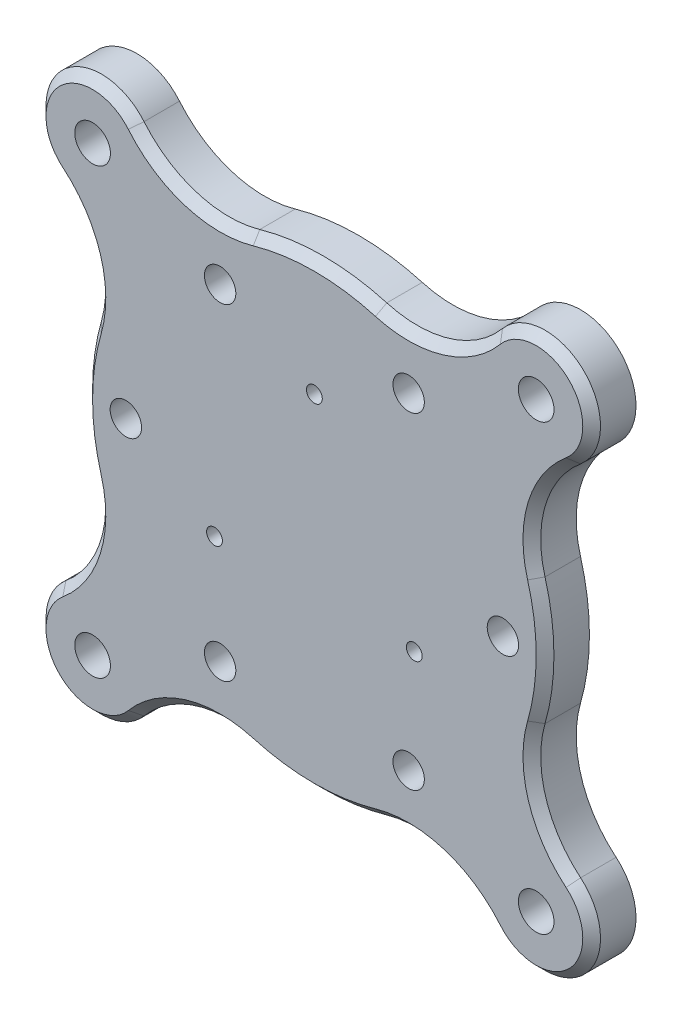
from build123d import *

# Parameters (mm, degrees)
SKETCH1_R                                      = 53.975
BOSS_EXTRUDE1_DEPTH                            = 6.35
CSK_FOR_8_FLAT_HEAD_MACHINE_SCREW1_D           = 4.4958
CSK_FOR_8_FLAT_HEAD_MACHINE_SCREW1_CSINK_D     = 9.7575878
CSK_FOR_8_FLAT_HEAD_MACHINE_SCREW1_CSINK_ANGLE = 82
CIRPATTERN1_COUNT                              = 6
F_10_CLEARANCE_HOLE1_D                         = 5.1054
CIRPATTERN2_COUNT                              = 4
F_4_40_TAPPED_HOLE1_D                          = 2.2606
CIRPATTERN3_COUNT                              = 3
CUT_EXTRUDE2_DEPTH                             = 77.59584682
CIRPATTERN4_COUNT                              = 4
CHAMFER1_SIZE                                  = 1.27


with BuildPart() as part:
    # Sketch1 → Boss-Extrude1 (new body)
    with BuildSketch(Plane.XY):
        Circle(SKETCH1_R)
    extrude(amount=BOSS_EXTRUDE1_DEPTH)

    # CSK for #8 Flat Head Machine Screw1 (through all)
    with Locations(Plane(origin=(0, 0, 0), x_dir=(-1, 0, 0), z_dir=(0, 0, -1))):
        with Locations((-13.49375, 23.371860585)):
            csk_for_8_flat_head_machine_screw1 = CounterSinkHole(CSK_FOR_8_FLAT_HEAD_MACHINE_SCREW1_D / 2, CSK_FOR_8_FLAT_HEAD_MACHINE_SCREW1_CSINK_D / 2, counter_sink_angle=CSK_FOR_8_FLAT_HEAD_MACHINE_SCREW1_CSINK_ANGLE)

    # CirPattern1: CSK for #8 Flat Head Machine Screw1 ×6 about axis
    cirpattern1_axis = Axis((0, 0, 0), (0, 0, 1))
    for i in range(1, CIRPATTERN1_COUNT):
        add(csk_for_8_flat_head_machine_screw1.rotate(cirpattern1_axis, i * 360 / CIRPATTERN1_COUNT), mode=Mode.SUBTRACT)

    # #10 Clearance Hole1 (through all)
    with Locations(Plane.XY.offset(6.35)):
        with Locations((31.75, 31.75)):
            f_10_clearance_hole1 = Hole(F_10_CLEARANCE_HOLE1_D / 2)

    # CirPattern2: #10 Clearance Hole1 ×4 about axis
    cirpattern2_axis = Axis((0, 0, 0), (0, 0, 1))
    for i in range(1, CIRPATTERN2_COUNT):
        add(f_10_clearance_hole1.rotate(cirpattern2_axis, i * 360 / CIRPATTERN2_COUNT), mode=Mode.SUBTRACT)

    # #4-40 Tapped Hole1 (through all)
    with Locations(Plane.XY.offset(6.35)):
        with Locations((0, 16.51)):
            f_4_40_tapped_hole1 = Hole(F_4_40_TAPPED_HOLE1_D / 2)

    # CirPattern3: #4-40 Tapped Hole1 ×3 about axis
    cirpattern3_axis = Axis((0, 0, 0), (0, 0, 1))
    for i in range(1, CIRPATTERN3_COUNT):
        add(f_4_40_tapped_hole1.rotate(cirpattern3_axis, i * 360 / CIRPATTERN3_COUNT), mode=Mode.SUBTRACT)

    # Sketch9 → Cut-Extrude2 (cut, through all)
    with BuildSketch(Plane(origin=(0, 0, 0), x_dir=(-1, 0, 0), z_dir=(0, 0, -1))):
        with BuildLine():
            Line((-37.362660076, 37.362660076), (-38.166088515, 38.166088515))
            ThreePointArc((-38.166088515, 38.166088515), (0, 53.975), (38.166088515, 38.166088515))
            Line((38.166088515, 38.166088515), (37.362660076, 37.362660076))
            ThreePointArc((37.362660076, 37.362660076), (31.392484898, 39.679444445), (25.65502333, 36.834797503))
            ThreePointArc((25.65502333, 36.834797503), (18.130045784, 31.830282128), (9.09329402, 31.74322611))
            ThreePointArc((9.09329402, 31.74322611), (0, 33.02), (-9.09329402, 31.74322611))
            ThreePointArc((-9.09329402, 31.74322611), (-18.130045784, 31.830282128), (-25.65502333, 36.834797503))
            ThreePointArc((-25.65502333, 36.834797503), (-31.392484898, 39.679444445), (-37.362660076, 37.362660076))
        make_face()
    cut_extrude2 = extrude(amount=-CUT_EXTRUDE2_DEPTH, mode=Mode.SUBTRACT)

    # CirPattern4: Cut-Extrude2 ×4 about axis
    cirpattern4_axis = Axis((0, 0, 0), (0, 0, 1))
    for i in range(1, CIRPATTERN4_COUNT):
        add(cut_extrude2.rotate(cirpattern4_axis, i * 360 / CIRPATTERN4_COUNT), mode=Mode.SUBTRACT)

    # Chamfer1
    chamfer1_edges = [part.edges().sort_by_distance(p)[0] for p in [
        (37.362660076, 37.362660076, 6.35),
        (-37.362660076, 37.362660076, 6.35),
        (-18.130045784, 31.830282128, 6.35),
        (0, 33.02, 6.35),
        (18.130045784, 31.830282128, 6.35),
        (37.362660076, -37.362660076, 6.35),
        (31.830282128, 18.130045784, 6.35),
        (33.02, 0, 6.35),
        (31.830282128, -18.130045784, 6.35),
        (-37.362660076, -37.362660076, 6.35),
        (18.130045784, -31.830282128, 6.35),
        (0, -33.02, 6.35),
        (-18.130045784, -31.830282128, 6.35),
        (-31.830282128, -18.130045784, 6.35),
        (-33.02, 0, 6.35),
        (-31.830282128, 18.130045784, 6.35),
    ]]
    chamfer(chamfer1_edges, length=CHAMFER1_SIZE)


solid = part.part
